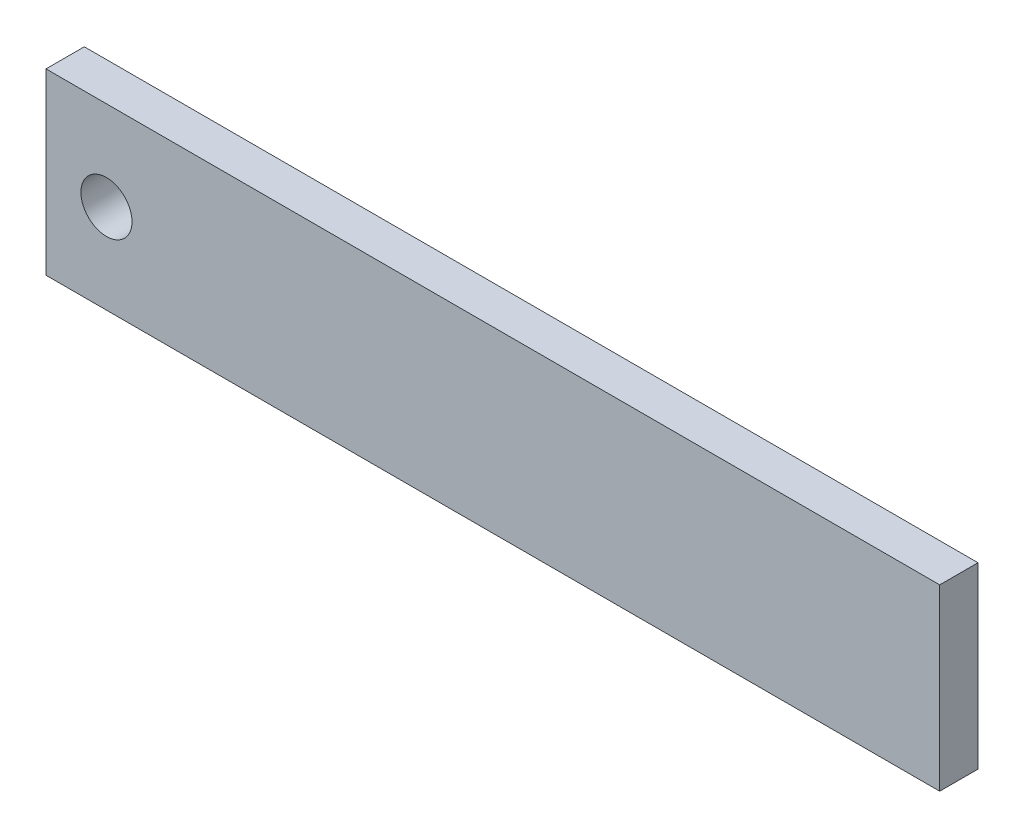
from build123d import *

# Parameters (mm, degrees)
CROQUIS1_W              = 350
CROQUIS1_H              = 70
SALIENTE_EXTRUIR1_DEPTH = 15
CROQUIS2_R              = 10
CORTAR_EXTRUIR1_DEPTH   = 130


with BuildPart() as part:
    # Croquis1 → Saliente-Extruir1 (new body)
    with BuildSketch(Plane.XY):
        with Locations((175, 35)):
            Rectangle(CROQUIS1_W, CROQUIS1_H)
    extrude(amount=SALIENTE_EXTRUIR1_DEPTH)

    # Croquis2 → Cortar-Extruir1 (cut)
    with BuildSketch(Plane.XY.offset(15)):
        with Locations((23.676832776, 35)):
            Circle(CROQUIS2_R)
    extrude(amount=-CORTAR_EXTRUIR1_DEPTH, mode=Mode.SUBTRACT)


solid = part.part
